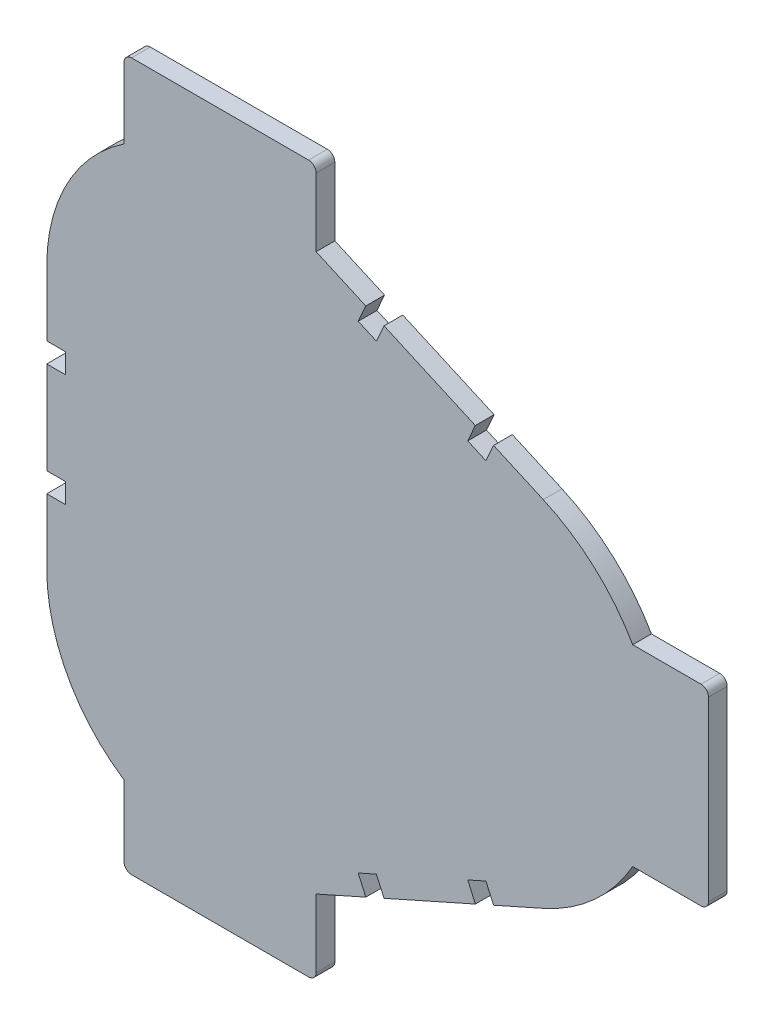
from build123d import *

# Parameters (mm, degrees)
SKETCH1_W           = 6.35
SKETCH1_H           = 3.0988
SKETCH1_H_2         = 25.146
BOSS_EXTRUDE1_DEPTH = 6.35


with BuildPart() as part:
    # Sketch1 → Boss-Extrude1 (new body)
    with BuildSketch(Plane(origin=(0, 0, -130.81), x_dir=(-1, 0, 0), z_dir=(0, 0, -1))):
        with BuildLine():
            Line((70.526798569, 59.314378099), (70.526798569, 62.413178099))
            Line((70.526798569, 62.413178099), (70.526798569, 81.336178099))
            ThreePointArc((70.526798569, 81.336178099), (63.856531257, 106.917123969), (45.544320246, 125.983853774))
            ThreePointArc((45.544320246, 125.983853774), (44.656455469, 126.90830128), (44.333048569, 128.148589564))
            Line((44.333048569, 128.148589564), (44.333048569, 147.869312576))
            ThreePointArc((44.333048569, 147.869312576), (43.589099793, 149.6653638), (41.793048569, 150.409312576))
            Line((41.793048569, 150.409312576), (-5.514451431, 150.409312576))
            ThreePointArc((-5.514451431, 150.409312576), (-7.310502655, 149.6653638), (-8.054451431, 147.869312576))
            Line((-8.054451431, 147.869312576), (-8.054451431, 128.668205083))
            ThreePointArc((-8.054451431, 128.668205083), (-8.464181451, 127.284893905), (-9.561183568, 126.347869434))
            Line((-9.561183568, 126.347869434), (-25.826658021, 119.104696647))
            Line((-25.826658021, 119.104696647), (-28.657467512, 117.844109854))
            Line((-28.657467512, 117.844109854), (-34.829560338, 115.095617339))
            Line((-34.829560338, 115.095617339), (-37.66036983, 113.835030546))
            Line((-37.66036983, 113.835030546), (-62.952028403, 102.57241084))
            Line((-62.952028403, 102.57241084), (-65.782837894, 101.311824047))
            Line((-65.782837894, 101.311824047), (-71.95493072, 98.563331532))
            Line((-71.95493072, 98.563331532), (-74.785740212, 97.302744739))
            Line((-74.785740212, 97.302744739), (-88.791116459, 91.0660155))
            ThreePointArc((-88.791116459, 91.0660155), (-105.234258555, 80.148597196), (-117.184308425, 64.439897298))
            ThreePointArc((-117.184308425, 64.439897298), (-118.119343883, 63.446350606), (-119.433558814, 63.079928099))
            Line((-119.433558814, 63.079928099), (-138.48728746, 63.079928099))
            ThreePointArc((-138.48728746, 63.079928099), (-140.283338684, 62.335979323), (-141.02728746, 60.539928099))
            Line((-141.02728746, 60.539928099), (-141.02728746, 13.232428099))
            ThreePointArc((-141.02728746, 13.232428099), (-140.283338684, 11.436376875), (-138.48728746, 10.692428099))
            Line((-138.48728746, 10.692428099), (-119.433558814, 10.692428099))
            ThreePointArc((-119.433558814, 10.692428099), (-118.119343883, 10.326005592), (-117.184308425, 9.3324589))
            ThreePointArc((-117.184308425, 9.3324589), (-105.234258555, -6.376240998), (-88.791116459, -17.293659302))
            Line((-88.791116459, -17.293659302), (-74.785740212, -23.530388541))
            Line((-74.785740212, -23.530388541), (-71.95493072, -24.790975333))
            Line((-71.95493072, -24.790975333), (-65.782837894, -27.539467849))
            Line((-65.782837894, -27.539467849), (-62.952028403, -28.800054642))
            Line((-62.952028403, -28.800054642), (-37.66036983, -40.062674348))
            Line((-37.66036983, -40.062674348), (-34.829560338, -41.323261141))
            Line((-34.829560338, -41.323261141), (-28.657467512, -44.071753656))
            Line((-28.657467512, -44.071753656), (-25.826658021, -45.332340449))
            Line((-25.826658021, -45.332340449), (-9.561183568, -52.575513236))
            ThreePointArc((-9.561183568, -52.575513236), (-8.464181451, -53.512537707), (-8.054451431, -54.895848885))
            Line((-8.054451431, -54.895848885), (-8.054451431, -76.636956378))
            Line((-8.054451431, -76.636956378), (44.333048569, -76.636956378))
            Line((44.333048569, -76.636956378), (44.333048569, -54.376233366))
            ThreePointArc((44.333048569, -54.376233366), (44.656455469, -53.135945082), (45.544320246, -52.211497576))
            ThreePointArc((45.544320246, -52.211497576), (63.856531257, -33.144767771), (70.526798569, -7.563821901))
            Line((70.526798569, -7.563821901), (70.526798569, 11.359178099))
            Line((70.526798569, 11.359178099), (70.526798569, 14.457978099))
            Line((70.526798569, 14.457978099), (70.526798569, 21.214378099))
            Line((70.526798569, 21.214378099), (70.526798569, 24.313178099))
            Line((70.526798569, 24.313178099), (70.526798569, 49.459178099))
            Line((70.526798569, 49.459178099), (70.526798569, 52.557978099))
            Line((70.526798569, 52.557978099), (70.526798569, 59.314378099))
        make_face()
        with Locations((73.701798569, 60.863778099)):
            Rectangle(SKETCH1_W, SKETCH1_H)
        with BuildLine():
            Line((70.526798569, 81.336178099), (70.526798569, 62.413178099))
            Line((70.526798569, 62.413178099), (76.876798569, 62.413178099))
            Line((76.876798569, 62.413178099), (76.876798569, 81.336178099))
            ThreePointArc((76.876798569, 81.336178099), (69.915897636, 109.072033869), (50.683048569, 130.234012838))
            Line((50.683048569, 130.234012838), (50.683048569, 154.219312576))
            ThreePointArc((50.683048569, 154.219312576), (49.939099793, 156.0153638), (48.143048569, 156.759312576))
            Line((48.143048569, 156.759312576), (-11.864451431, 156.759312576))
            ThreePointArc((-11.864451431, 156.759312576), (-13.660502655, 156.0153638), (-14.404451431, 154.219312576))
            Line((-14.404451431, 154.219312576), (-14.404451431, 131.142265008))
            Line((-14.404451431, 131.142265008), (-28.409827678, 124.905535769))
            Line((-28.409827678, 124.905535769), (-25.826658021, 119.104696647))
            Line((-25.826658021, 119.104696647), (-9.561183568, 126.347869434))
            ThreePointArc((-9.561183568, 126.347869434), (-8.464181451, 127.284893905), (-8.054451431, 128.668205083))
            Line((-8.054451431, 128.668205083), (-8.054451431, 147.869312576))
            ThreePointArc((-8.054451431, 147.869312576), (-7.310502655, 149.6653638), (-5.514451431, 150.409312576))
            Line((-5.514451431, 150.409312576), (41.793048569, 150.409312576))
            ThreePointArc((41.793048569, 150.409312576), (43.589099793, 149.6653638), (44.333048569, 147.869312576))
            Line((44.333048569, 147.869312576), (44.333048569, 128.148589564))
            ThreePointArc((44.333048569, 128.148589564), (44.656455469, 126.90830128), (45.544320246, 125.983853774))
            ThreePointArc((45.544320246, 125.983853774), (63.856531257, 106.917123969), (70.526798569, 81.336178099))
        make_face()
        with Locations((73.701798569, 51.008578099)):
            Rectangle(SKETCH1_W, SKETCH1_H)
        with Locations((73.701798569, 36.886178099)):
            Rectangle(SKETCH1_W, SKETCH1_H_2)
        with Locations((73.701798569, 22.763778099)):
            Rectangle(SKETCH1_W, SKETCH1_H)
        with Locations((73.701798569, 12.908578099)):
            Rectangle(SKETCH1_W, SKETCH1_H)
        with BuildLine():
            Line((76.876798569, 11.359178099), (70.526798569, 11.359178099))
            Line((70.526798569, 11.359178099), (70.526798569, -7.563821901))
            ThreePointArc((70.526798569, -7.563821901), (63.856531257, -33.144767771), (45.544320246, -52.211497576))
            ThreePointArc((45.544320246, -52.211497576), (44.656455469, -53.135945082), (44.333048569, -54.376233366))
            Line((44.333048569, -54.376233366), (44.333048569, -76.636956378))
            Line((44.333048569, -76.636956378), (-8.054451431, -76.636956378))
            Line((-8.054451431, -76.636956378), (-8.054451431, -54.895848885))
            ThreePointArc((-8.054451431, -54.895848885), (-8.464181451, -53.512537707), (-9.561183568, -52.575513236))
            Line((-9.561183568, -52.575513236), (-25.826658021, -45.332340449))
            Line((-25.826658021, -45.332340449), (-28.409827678, -51.133179571))
            Line((-28.409827678, -51.133179571), (-14.404451431, -57.36990881))
            Line((-14.404451431, -57.36990881), (-14.404451431, -80.446956378))
            ThreePointArc((-14.404451431, -80.446956378), (-13.660502655, -82.243007602), (-11.864451431, -82.986956378))
            Line((-11.864451431, -82.986956378), (48.143048569, -82.986956378))
            ThreePointArc((48.143048569, -82.986956378), (49.939099793, -82.243007602), (50.683048569, -80.446956378))
            Line((50.683048569, -80.446956378), (50.683048569, -56.46165664))
            ThreePointArc((50.683048569, -56.46165664), (69.915897636, -35.299677671), (76.876798569, -7.563821901))
            Line((76.876798569, -7.563821901), (76.876798569, 11.359178099))
        make_face()
        Polygon((-28.409827678, -51.133179571), (-25.826658021, -45.332340449), (-28.657467512, -44.071753656), (-31.24063717, -49.872592778), align=None)
        Polygon((-37.412729996, -47.124100263), (-34.829560338, -41.323261141), (-37.66036983, -40.062674348), (-40.243539487, -45.86351347), align=None)
        Polygon((-40.243539487, -45.86351347), (-37.66036983, -40.062674348), (-62.952028403, -28.800054642), (-65.53519806, -34.600893764), align=None)
        Polygon((-65.53519806, -34.600893764), (-62.952028403, -28.800054642), (-65.782837894, -27.539467849), (-68.366007552, -33.340306971), align=None)
        with BuildLine():
            Line((-74.785740212, 97.302744739), (-77.368909869, 103.103583861))
            Line((-77.368909869, 103.103583861), (-91.374286117, 96.866854622))
            ThreePointArc((-91.374286117, 96.866854622), (-108.722690302, 85.568449718), (-121.690697129, 69.429928099))
            Line((-121.690697129, 69.429928099), (-144.83728746, 69.429928099))
            ThreePointArc((-144.83728746, 69.429928099), (-146.633338684, 68.685979323), (-147.37728746, 66.889928099))
            Line((-147.37728746, 66.889928099), (-147.37728746, 6.882428099))
            ThreePointArc((-147.37728746, 6.882428099), (-146.633338684, 5.086376875), (-144.83728746, 4.342428099))
            Line((-144.83728746, 4.342428099), (-121.690697129, 4.342428099))
            ThreePointArc((-121.690697129, 4.342428099), (-108.722690302, -11.79609352), (-91.374286117, -23.094498424))
            Line((-91.374286117, -23.094498424), (-77.368909869, -29.331227663))
            Line((-77.368909869, -29.331227663), (-74.785740212, -23.530388541))
            Line((-74.785740212, -23.530388541), (-88.791116459, -17.293659302))
            ThreePointArc((-88.791116459, -17.293659302), (-105.234258555, -6.376240998), (-117.184308425, 9.3324589))
            ThreePointArc((-117.184308425, 9.3324589), (-118.119343883, 10.326005592), (-119.433558814, 10.692428099))
            Line((-119.433558814, 10.692428099), (-138.48728746, 10.692428099))
            ThreePointArc((-138.48728746, 10.692428099), (-140.283338684, 11.436376875), (-141.02728746, 13.232428099))
            Line((-141.02728746, 13.232428099), (-141.02728746, 60.539928099))
            ThreePointArc((-141.02728746, 60.539928099), (-140.283338684, 62.335979323), (-138.48728746, 63.079928099))
            Line((-138.48728746, 63.079928099), (-119.433558814, 63.079928099))
            ThreePointArc((-119.433558814, 63.079928099), (-118.119343883, 63.446350606), (-117.184308425, 64.439897298))
            ThreePointArc((-117.184308425, 64.439897298), (-105.234258555, 80.148597196), (-88.791116459, 91.0660155))
            Line((-88.791116459, 91.0660155), (-74.785740212, 97.302744739))
        make_face()
        Polygon((-74.538100378, -30.591814456), (-71.95493072, -24.790975333), (-74.785740212, -23.530388541), (-77.368909869, -29.331227663), align=None)
        Polygon((-37.66036983, 113.835030546), (-40.243539487, 119.635869668), (-65.53519806, 108.373249962), (-62.952028403, 102.57241084), align=None)
        Polygon((-34.829560338, 115.095617339), (-37.412729996, 120.896456461), (-40.243539487, 119.635869668), (-37.66036983, 113.835030546), align=None)
        Polygon((-25.826658021, 119.104696647), (-28.409827678, 124.905535769), (-31.24063717, 123.644948976), (-28.657467512, 117.844109854), align=None)
        Polygon((-62.952028403, 102.57241084), (-65.53519806, 108.373249962), (-68.366007552, 107.112663169), (-65.782837894, 101.311824047), align=None)
        Polygon((-71.95493072, 98.563331532), (-74.538100378, 104.364170654), (-77.368909869, 103.103583861), (-74.785740212, 97.302744739), align=None)
    extrude(amount=BOSS_EXTRUDE1_DEPTH)


solid = part.part
